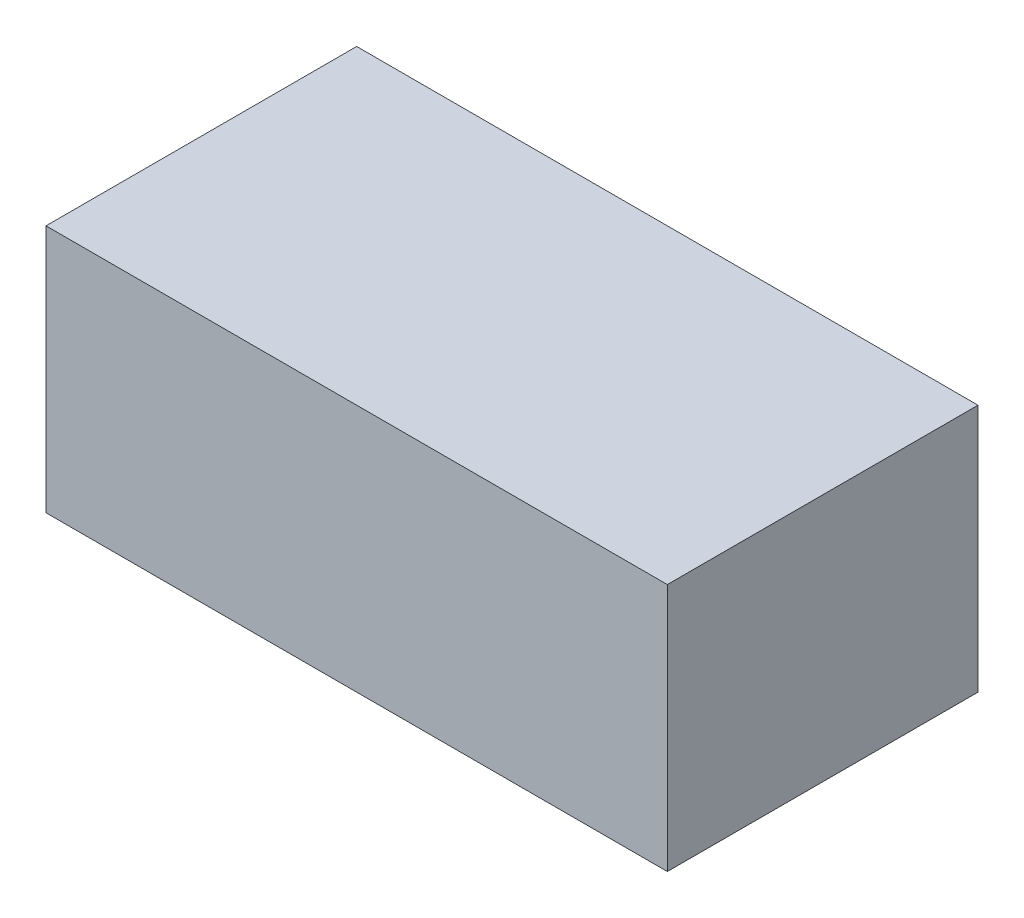
from build123d import *

# Parameters (mm, degrees)
SKETCH1_W           = 100
SKETCH1_H           = 50
BOSS_EXTRUDE1_DEPTH = 40


with BuildPart() as part:
    # Sketch1 → Boss-Extrude1 (new body)
    with BuildSketch(Plane(origin=(0, 0, 0), x_dir=(1, 0, 0), z_dir=(0, 1, 0))):
        Rectangle(SKETCH1_W, SKETCH1_H)
    extrude(amount=BOSS_EXTRUDE1_DEPTH)


solid = part.part
